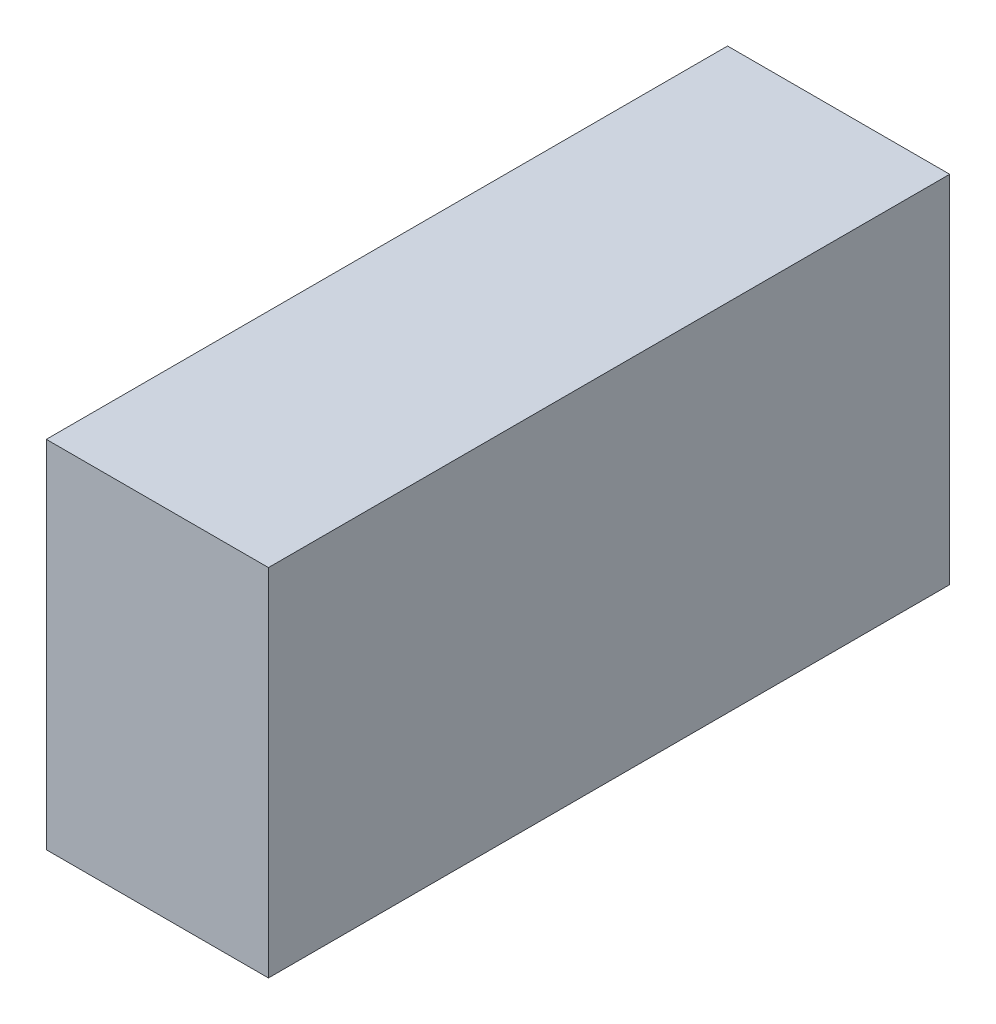
from build123d import *

# Parameters (mm, degrees)
SKETCH2_W               = 45
SKETCH2_H               = 138
F_6500MAH_BATTERY_DEPTH = 72


with BuildPart() as part:
    # Sketch2 → 6500mah battery (new body)
    with BuildSketch(Plane(origin=(0, 0, 0), x_dir=(1, 0, 0), z_dir=(0, 1, 0))):
        Rectangle(SKETCH2_W, SKETCH2_H)
    extrude(amount=F_6500MAH_BATTERY_DEPTH)


solid = part.part
